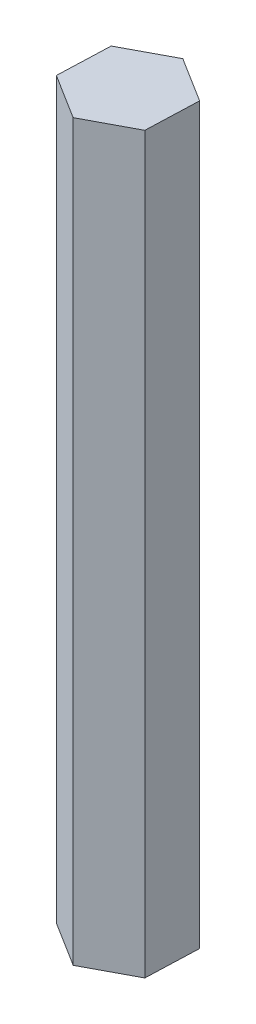
from build123d import *

# Parameters (mm, degrees)
BOSS_EXTRUDE1_DEPTH = 50.8


with BuildPart() as part:
    # Sketch1 → Boss-Extrude1 (new body)
    with BuildSketch(Plane(origin=(0, 0, 0), x_dir=(1, 0, 0), z_dir=(0, 1, 0))):
        Polygon((3.237656075, 1.72000479), (0.129260195, 3.663894804), (-3.10839588, 1.943890014), (-3.237656075, -1.72000479), (-0.129260195, -3.663894804), (3.10839588, -1.943890014), align=None)
    extrude(amount=BOSS_EXTRUDE1_DEPTH)


solid = part.part
